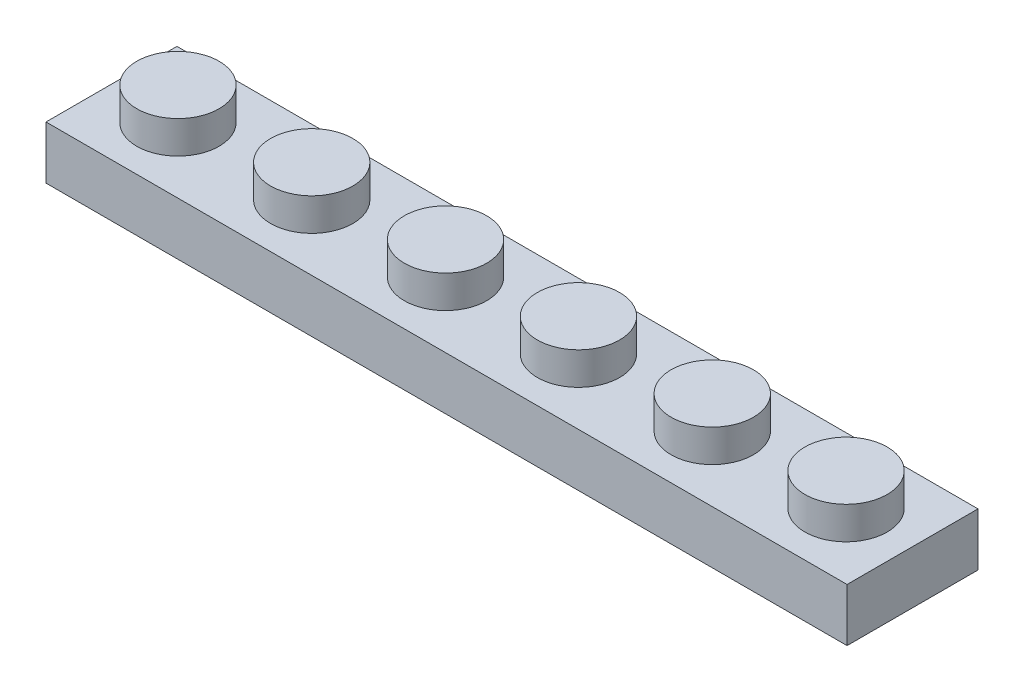
from build123d import *

# Parameters (mm, degrees)
SKETCH2_W           = 47.78
SKETCH2_H           = 3.16
BOSS_EXTRUDE1_DEPTH = 7.81
SKETCH3_R           = 2.455
BOSS_EXTRUDE2_DEPTH = 1.94
SHELL1_T            = -1.6
SKETCH4_R           = 1.495
SKETCH4_R_2         = 0.595
BOSS_EXTRUDE3_DEPTH = 1.36


with BuildPart() as part:
    # Sketch2 → Boss-Extrude1 (new body)
    with BuildSketch(Plane.XY):
        Rectangle(SKETCH2_W, SKETCH2_H)
    extrude(amount=-BOSS_EXTRUDE1_DEPTH)

    # Sketch3 → Boss-Extrude2 (add)
    with BuildSketch(Plane(origin=(0, 1.58, 0), x_dir=(1, 0, 0), z_dir=(0, 1, 0))):
        with Locations(Location((-19.925, 3.905, 0), (0, 0, 270))):
            Circle(SKETCH3_R)
        with Locations(Location((-11.945, 3.905, 0), (0, 0, 270))):
            Circle(SKETCH3_R)
        with Locations(Location((-3.965, 3.905, 0), (0, 0, 270))):
            Circle(SKETCH3_R)
        with Locations(Location((3.965, 3.905, 0), (0, 0, 90))):
            Circle(SKETCH3_R)
        with Locations(Location((11.945, 3.905, 0), (0, 0, 90))):
            Circle(SKETCH3_R)
        with Locations(Location((19.925, 3.905, 0), (0, 0, 90))):
            Circle(SKETCH3_R)
    extrude(amount=BOSS_EXTRUDE2_DEPTH)

    # Shell1
    shell1_openings = [part.faces().sort_by_distance(p)[0] for p in [
        (0, -1.58, -3.905),
    ]]
    offset(amount=SHELL1_T, openings=shell1_openings, kind=Kind.INTERSECTION)

    # Sketch4 → Boss-Extrude3 (add)
    # profile 1 of 5: a face of its own
    with BuildSketch(Plane.XZ.offset(0.02)):
        with Locations(Location((-15.935, -3.905, 0), (0, 0, 90))):
            Circle(SKETCH4_R)
        with Locations(Location((-15.935, -3.905, 0), (0, 0, 270))):
            Circle(SKETCH4_R_2, mode=Mode.SUBTRACT)
    # profile 2 of 5: a face of its own
    with BuildSketch(Plane.XZ.offset(0.02)):
        with Locations(Location((-7.955, -3.905, 0), (0, 0, 90))):
            Circle(SKETCH4_R)
        with Locations(Location((-7.955, -3.905, 0), (0, 0, 270))):
            Circle(SKETCH4_R_2, mode=Mode.SUBTRACT)
    # profile 3 of 5: a face of its own
    with BuildSketch(Plane.XZ.offset(0.02)):
        with Locations(Location((0, -3.905, 0), (0, 0, 90))):
            Circle(SKETCH4_R)
        with Locations(Location((0, -3.905, 0), (0, 0, 270))):
            Circle(SKETCH4_R_2, mode=Mode.SUBTRACT)
    # profile 4 of 5: a face of its own
    with BuildSketch(Plane.XZ.offset(0.02)):
        with Locations(Location((7.955, -3.905, 0), (0, 0, 90))):
            Circle(SKETCH4_R)
        with Locations(Location((7.955, -3.905, 0), (0, 0, 90))):
            Circle(SKETCH4_R_2, mode=Mode.SUBTRACT)
    # profile 5 of 5: a face of its own
    with BuildSketch(Plane.XZ.offset(0.02)):
        with Locations(Location((15.935, -3.905, 0), (0, 0, 90))):
            Circle(SKETCH4_R)
        with Locations(Location((15.935, -3.905, 0), (0, 0, 90))):
            Circle(SKETCH4_R_2, mode=Mode.SUBTRACT)
    extrude(amount=BOSS_EXTRUDE3_DEPTH)


solid = part.part
